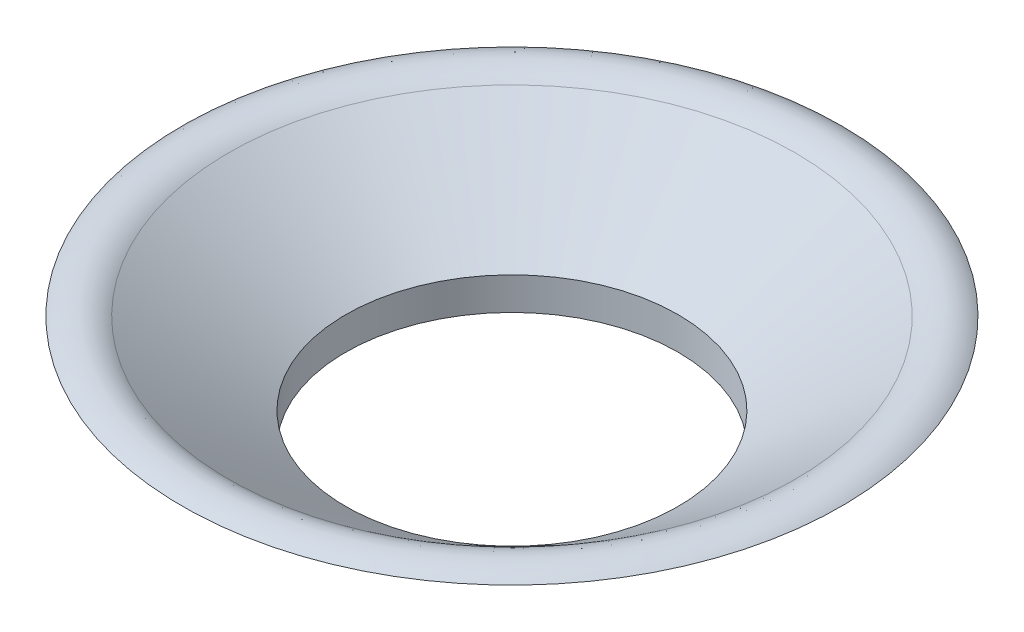
from build123d import *


with BuildPart() as part:
    # Sketch1 → Revolve1 (revolve)
    with BuildSketch(Plane.XY, mode=Mode.PRIVATE) as revolve1_sk:
        with BuildLine():
            Line((50, 0), (99.149122657, 34.414586181))
            ThreePointArc((99.149122657, 34.414586181), (92.151281138, 36.620997137), (85.153439619, 34.414586181))
            Line((85.153439619, 34.414586181), (50, 9.799882766))
            Line((50, 9.799882766), (50, 0))
        make_face()
    revolve(revolve1_sk.sketch.rotate(Axis((0, 0, 0), (0, 1, 0)), 90), axis=Axis((0, 0, 0), (0, 1, 0)))


solid = part.part
